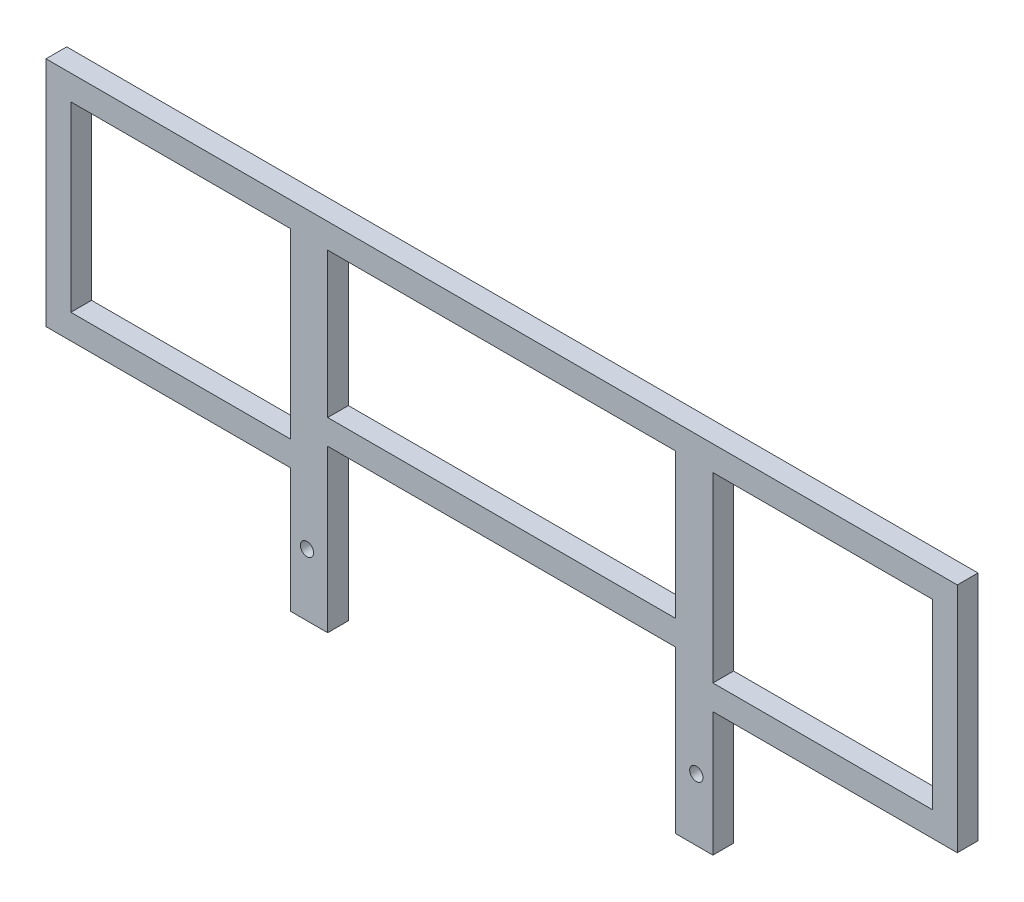
from build123d import *

# Parameters (mm, degrees)
SKETCH_1_W          = 53
SKETCH_1_H          = 44
SKETCH_1_W_2        = 84
SKETCH_1_H_2        = 35
EXTRUDE_1_DEPTH     = 5
SKETCH_2_R          = 1.6
CUT_EXTRUDE_1_DEPTH = 228.070473642


with BuildPart() as part:
    # 草图1 → 凸台-拉伸1 (new body)
    with BuildSketch(Plane.XY):
        Polygon((161, 0), (220, 0), (220, 56), (0, 56), (0, 0), (59, 0), (59, -30), (68, -30), (68, 9), (152, 9), (152, -30), (161, -30), align=None)
        with Locations((32.5, 28)):
            Rectangle(SKETCH_1_W, SKETCH_1_H, mode=Mode.SUBTRACT)
        with Locations((187.5, 28)):
            Rectangle(SKETCH_1_W, SKETCH_1_H, mode=Mode.SUBTRACT)
        with Locations((110, 32.5)):
            Rectangle(SKETCH_1_W_2, SKETCH_1_H_2, mode=Mode.SUBTRACT)
    extrude(amount=EXTRUDE_1_DEPTH)

    # 草图2 → 切除-拉伸1 (cut, through all)
    with BuildSketch(Plane.XY.offset(5)):
        with Locations((63, -15)):
            Circle(SKETCH_2_R)
        with Locations((157, -15)):
            Circle(SKETCH_2_R)
    extrude(amount=-CUT_EXTRUDE_1_DEPTH, mode=Mode.SUBTRACT)


solid = part.part
